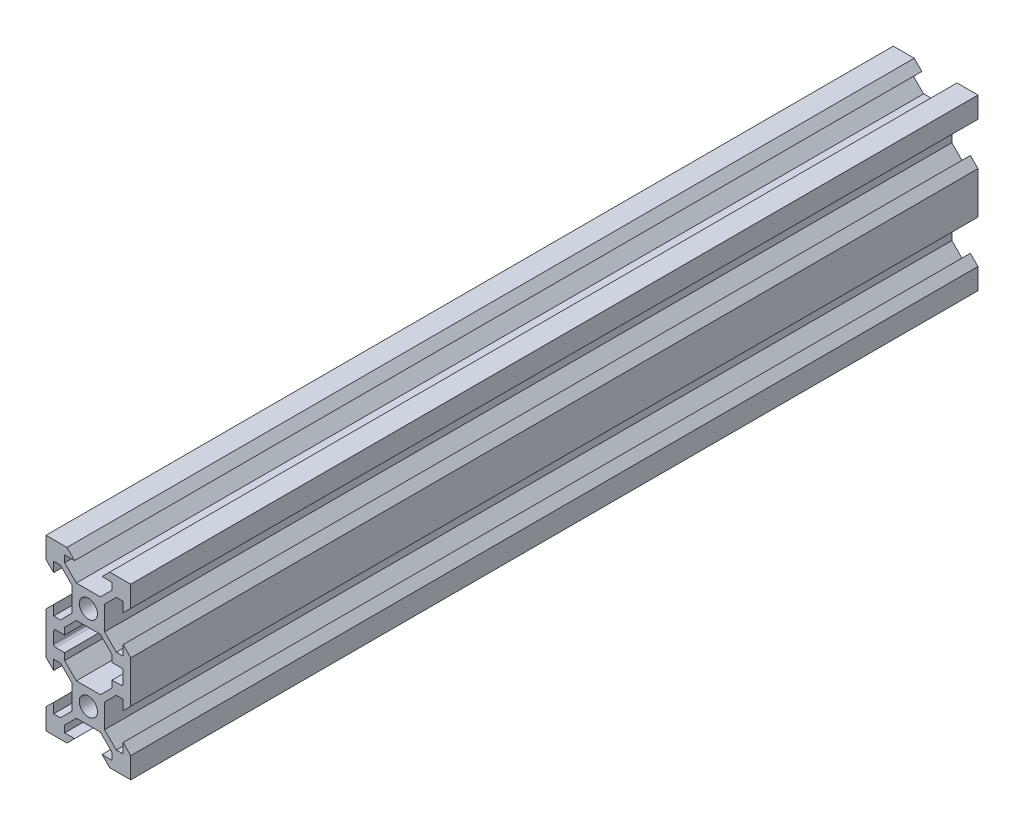
from build123d import *

# Parameters (mm, degrees)
CROQUIS1_R              = 2.15
SALIENTE_EXTRUIR1_DEPTH = 200


with BuildPart() as part:
    # Croquis1 → Saliente-Extruir1 (new body)
    with BuildSketch(Plane.XY):
        Polygon((20, 4.95), (18.2, 6.75), (18.2, 4.4), (16.589949494, 4.4), (13.825, 7.164949494), (13.825, 12.835050506), (16.589949494, 15.6), (18.2, 15.6), (18.2, 13.25), (20, 15.05), (20, 20), (15.05, 20), (13.25, 18.2), (15.6, 18.2), (15.6, 16.589949494), (12.835050506, 13.825), (7.164949494, 13.825), (4.4, 16.589949494), (4.4, 18.2), (6.75, 18.2), (4.95, 20), (0, 20), (0, 15.05), (1.8, 13.25), (1.8, 15.6), (3.410050506, 15.6), (6.175, 12.835050506), (6.175, 7.164949494), (3.410050506, 4.4), (1.8, 4.4), (1.8, 6.75), (0, 4.95), (0, -4.95), (1.8, -6.75), (1.8, -4.4), (3.410050506, -4.4), (6.175, -7.164949494), (6.175, -12.835050506), (3.410050506, -15.6), (1.8, -15.6), (1.8, -13.25), (0, -15.05), (0, -20), (4.95, -20), (6.75, -18.2), (4.4, -18.2), (4.4, -16.589949494), (7.164949494, -13.825), (12.835050506, -13.825), (15.6, -16.589949494), (15.6, -18.2), (13.25, -18.2), (15.05, -20), (20, -20), (20, -15.05), (18.2, -13.25), (18.2, -15.6), (16.589949494, -15.6), (13.825, -12.835050506), (13.825, -7.164949494), (16.589949494, -4.4), (18.2, -4.4), (18.2, -6.75), (20, -4.95), align=None)
        with BuildLine():
            Line((1.8, -1.3), (1.8, 1.3))
            ThreePointArc((1.8, 1.3), (1.946446609, 1.653553391), (2.3, 1.8))
            Line((2.3, 1.8), (4.4, 1.8))
            Line((4.4, 1.8), (4.4, 3.410050506))
            Line((4.4, 3.410050506), (7.164949494, 6.175))
            Line((7.164949494, 6.175), (12.835050506, 6.175))
            Line((12.835050506, 6.175), (15.6, 3.410050506))
            Line((15.6, 3.410050506), (15.6, 1.8))
            Line((15.6, 1.8), (17.7, 1.8))
            ThreePointArc((17.7, 1.8), (18.053553391, 1.653553391), (18.2, 1.3))
            Line((18.2, 1.3), (18.2, -1.3))
            ThreePointArc((18.2, -1.3), (18.053553391, -1.653553391), (17.7, -1.8))
            Line((17.7, -1.8), (15.6, -1.8))
            Line((15.6, -1.8), (15.6, -3.410050506))
            Line((15.6, -3.410050506), (12.835050506, -6.175))
            Line((12.835050506, -6.175), (7.164949494, -6.175))
            Line((7.164949494, -6.175), (4.4, -3.410050506))
            Line((4.4, -3.410050506), (4.4, -1.8))
            Line((4.4, -1.8), (2.3, -1.8))
            ThreePointArc((2.3, -1.8), (1.946446609, -1.653553391), (1.8, -1.3))
        make_face(mode=Mode.SUBTRACT)
        with Locations((10, -10)):
            Circle(CROQUIS1_R, mode=Mode.SUBTRACT)
        with Locations((10, 10)):
            Circle(CROQUIS1_R, mode=Mode.SUBTRACT)
    extrude(amount=SALIENTE_EXTRUIR1_DEPTH)


solid = part.part
